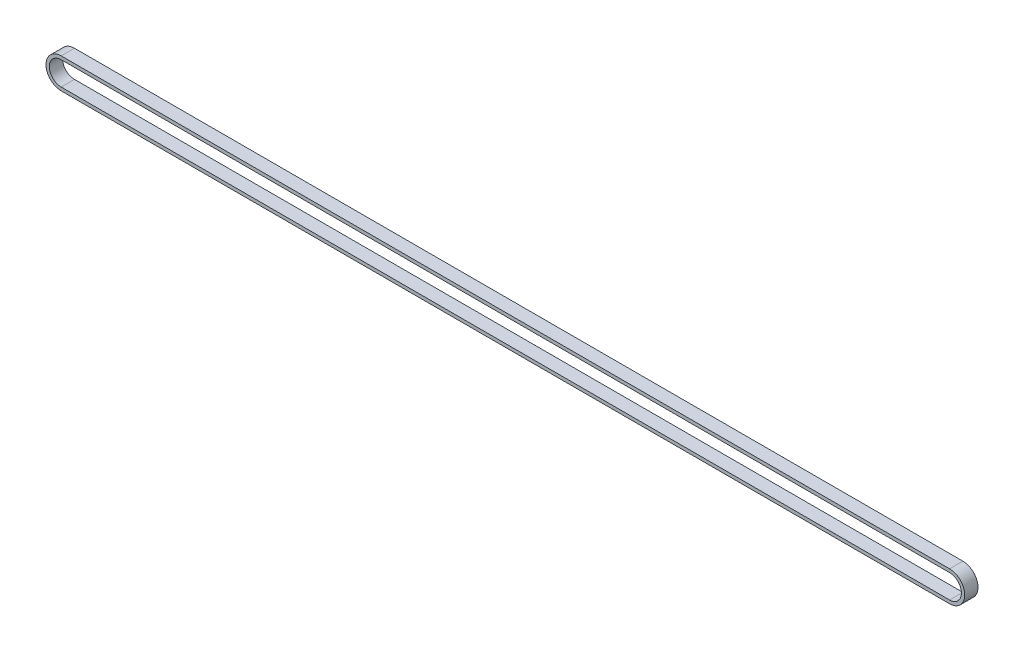
from build123d import *

# Parameters (mm, degrees)
EXTRUDE_THIN1_DEPTH = 3


with BuildPart() as part:
    # Sketch1 → Extrude-Thin1 (new, symmetric)
    with BuildSketch(Plane.XY):
        with BuildLine():
            Line((200.8, -6.85), (-200.8, -6.85))
            ThreePointArc((-200.8, -6.85), (-207.65, 0), (-200.8, 6.85))
            Line((-200.8, 6.85), (200.8, 6.85))
            ThreePointArc((200.8, 6.85), (207.65, 0), (200.8, -6.85))
        make_face()
        with BuildLine():
            Line((200.8, -5.35), (-200.8, -5.35))
            ThreePointArc((-200.8, -5.35), (-206.15, 0), (-200.8, 5.35))
            Line((-200.8, 5.35), (200.8, 5.35))
            ThreePointArc((200.8, 5.35), (206.15, 0), (200.8, -5.35))
        make_face(mode=Mode.SUBTRACT)
    extrude(amount=EXTRUDE_THIN1_DEPTH, both=True)


solid = part.part
